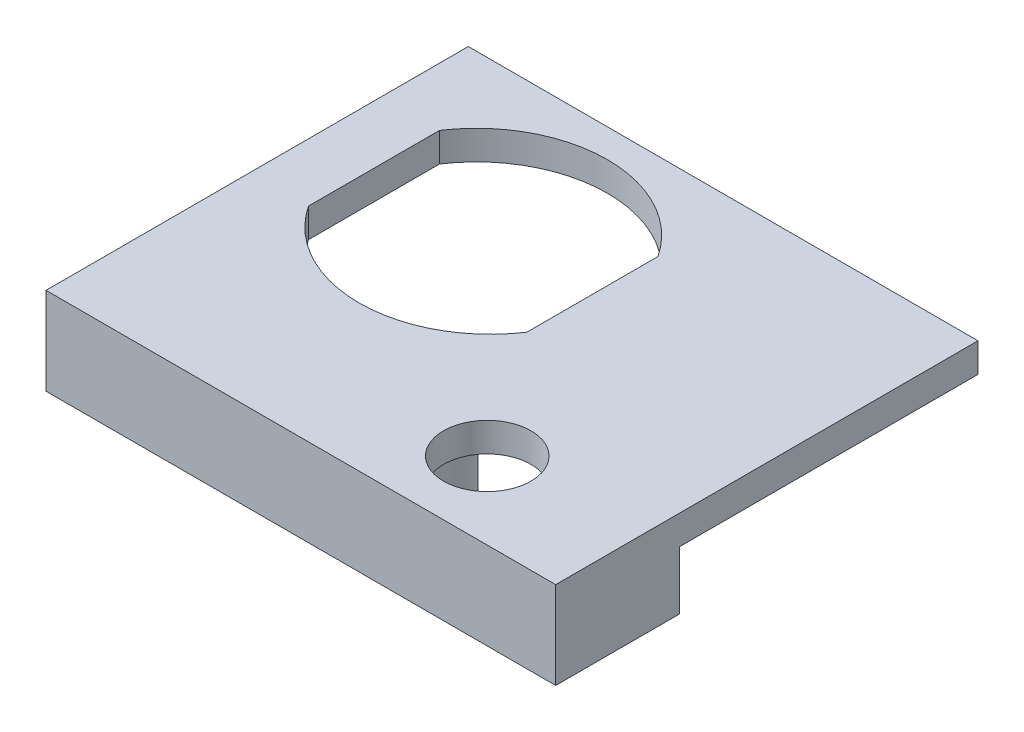
from build123d import *

# Parameters (mm, degrees)
CROQUIS1_R              = 1.5
SALIENTE_EXTRUIR1_DEPTH = 1
SALIENTE_EXTRUIR2_DEPTH = 2
CROQUIS3_W              = 2
CROQUIS3_H              = 6
SALIENTE_EXTRUIR3_DEPTH = 0.5


with BuildPart() as part:
    # Croquis1 → Saliente-Extruir1 (new body)
    with BuildSketch(Plane(origin=(0, 0, 0), x_dir=(1, 0, 0), z_dir=(0, 1, 0))):
        Polygon((-8.75, 7.25), (-6.75, 7.25), (0.75, 7.25), (8.75, 7.25), (8.75, -7.25), (-8.75, -7.25), align=None)
        with Locations(Location((3.75, -4.6, 0), (0, 0, 270))):
            Circle(CROQUIS1_R, mode=Mode.SUBTRACT)
        with BuildLine():
            Line((-6.75, 4.262531407), (-6.75, -0.237468593))
            ThreePointArc((-6.75, -0.237468593), (-3, -2.25), (0.75, -0.237468593))
            Line((0.75, -0.237468593), (0.75, 4.262531407))
            ThreePointArc((0.75, 4.262531407), (-3, 6.275062814), (-6.75, 4.262531407))
        make_face(mode=Mode.SUBTRACT)
    extrude(amount=SALIENTE_EXTRUIR1_DEPTH)

    # Croquis2 → Saliente-Extruir2 (add)
    with BuildSketch(Plane.XZ):
        with BuildLine():
            Line((-8.75, 7.25), (8.75, 7.25))
            Line((8.75, 7.25), (8.75, 3))
            Line((8.75, 3), (5.670937271, 3))
            ThreePointArc((5.670937271, 3), (3.75, 7.1), (1.829062729, 3))
            Line((1.829062729, 3), (-8.75, 3))
            Line((-8.75, 3), (-8.75, 7.25))
        make_face()
    extrude(amount=SALIENTE_EXTRUIR2_DEPTH)

    # Croquis3 → Saliente-Extruir3 (add)
    with BuildSketch(Plane.XZ):
        with Locations((2.75, -0.75)):
            Rectangle(CROQUIS3_W, CROQUIS3_H)
    extrude(amount=SALIENTE_EXTRUIR3_DEPTH)


solid = part.part
